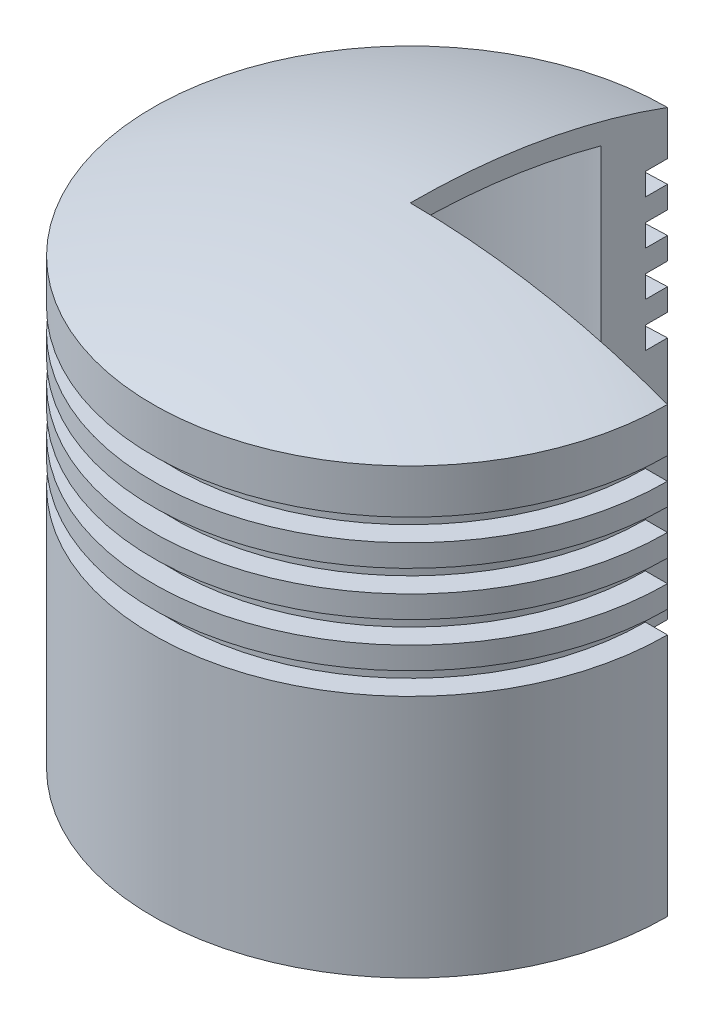
from build123d import *

# Parameters (mm, degrees)
REVOLVE1_ANGLE = 270


with BuildPart() as part:
    # Sketch1 → Revolve1 (revolve)
    with BuildSketch(Plane.XY):
        with BuildLine():
            Line((0, 167.582815348), (0, 163))
            ThreePointArc((0, 163), (21.692969078, 161.550038974), (43, 157.225952056))
            Line((43, 157.225952056), (43, 87.225952056))
            Line((43, 87.225952056), (50, 87.225952056))
            Line((50, 87.225952056), (50, 57.225952056))
            Line((50, 57.225952056), (58, 57.225952056))
            Line((58, 57.225952056), (58, 112.225952056))
            Line((58, 112.225952056), (53, 112.225952056))
            Line((53, 112.225952056), (53, 117.225952056))
            Line((53, 117.225952056), (58, 117.225952056))
            Line((58, 117.225952056), (58, 122.225952056))
            Line((58, 122.225952056), (53, 122.225952056))
            Line((53, 122.225952056), (53, 127.225952056))
            Line((53, 127.225952056), (58, 127.225952056))
            Line((58, 127.225952056), (58, 132.225952056))
            Line((58, 132.225952056), (53, 132.225952056))
            Line((53, 132.225952056), (53, 137.225952056))
            Line((53, 137.225952056), (58, 137.225952056))
            Line((58, 137.225952056), (58, 142.225952056))
            Line((58, 142.225952056), (53, 142.225952056))
            Line((53, 142.225952056), (53, 147.225952056))
            Line((53, 147.225952056), (58, 147.225952056))
            Line((58, 147.225952056), (58, 157.225952056))
            ThreePointArc((58, 157.225952056), (29.458719495, 164.973282218), (0, 167.582815348))
        make_face()
    revolve(axis=Axis((0, 598.051491246, 0), (0, -1, 0)), revolution_arc=REVOLVE1_ANGLE)


solid = part.part
